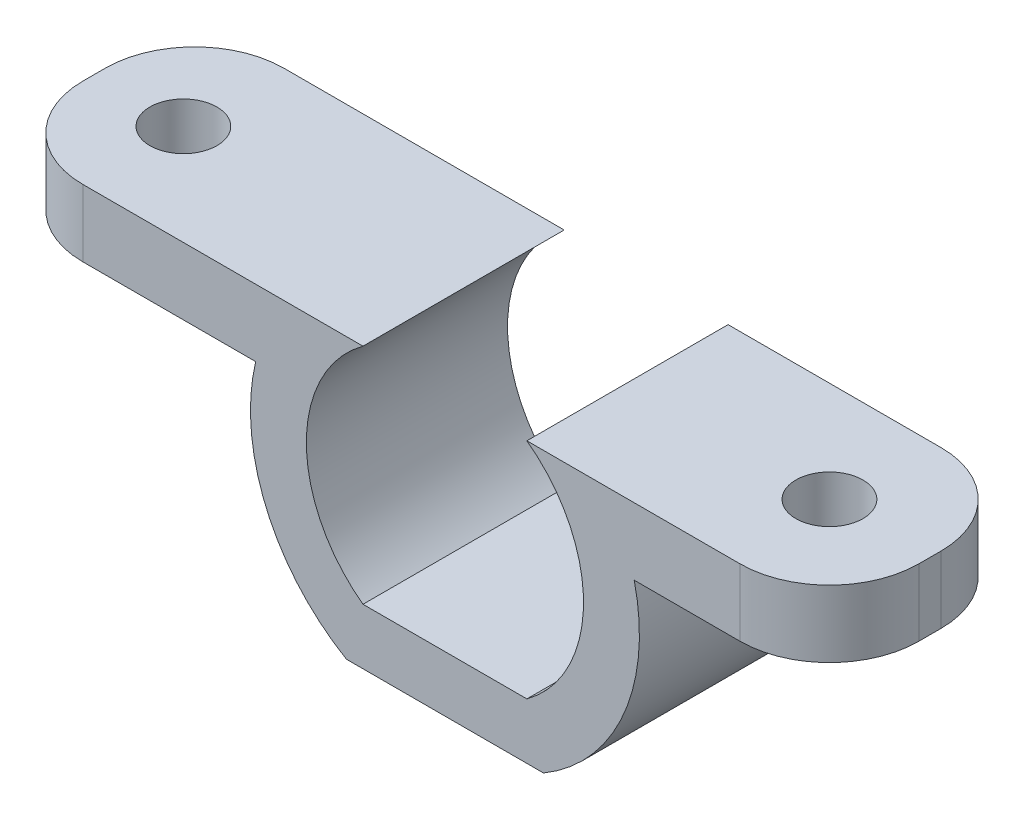
from build123d import *

# Parameters (mm, degrees)
BOSS_EXTRUDE1_DEPTH = 9
SKETCH2_R           = 1.5
CUT_EXTRUDE1_DEPTH  = 10
FILLET1_R           = 4


with BuildPart() as part:
    # Sketch1 → Boss-Extrude1 (new body)
    with BuildSketch(Plane.XY):
        with BuildLine():
            ThreePointArc((3.666060556, 5), (6.2, 0), (3.666060556, -5))
            Line((3.666060556, -5), (-3.666060556, -5))
            ThreePointArc((-3.666060556, -5), (-6.2, 0), (-3.666060556, 5))
            Line((-3.666060556, 5), (-20.2, 5))
            Line((-20.2, 5), (-20.2, 2))
            Line((-20.2, 2), (-8.466994744, 2))
            ThreePointArc((-8.466994744, 2), (-8.000677165, -3.41747932), (-4.409081537, -7.5))
            Line((-4.409081537, -7.5), (4.409081537, -7.5))
            ThreePointArc((4.409081537, -7.5), (8.000677165, -3.41747932), (8.466994744, 2))
            Line((8.466994744, 2), (17.2, 2))
            Line((17.2, 2), (17.2, 5))
            Line((17.2, 5), (3.666060556, 5))
        make_face()
    extrude(amount=BOSS_EXTRUDE1_DEPTH)

    # Sketch2 → Cut-Extrude1 (cut)
    with BuildSketch(Plane.XZ.offset(-2)):
        with Locations(Location((-16.2, 4.5, 0), (0, 0, 270))):
            Circle(SKETCH2_R)
        with Locations(Location((12.7, 4.5, 0), (0, 0, 270))):
            Circle(SKETCH2_R)
    extrude(amount=-CUT_EXTRUDE1_DEPTH, mode=Mode.SUBTRACT)

    # Fillet1
    fillet1_edges = [part.edges().sort_by_distance(p)[0] for p in [
        (-20.2, 3.5, 0),
        (17.2, 3.5, 0),
        (17.2, 3.5, 9),
        (-20.2, 3.5, 9),
    ]]
    fillet(fillet1_edges, radius=FILLET1_R)


solid = part.part
